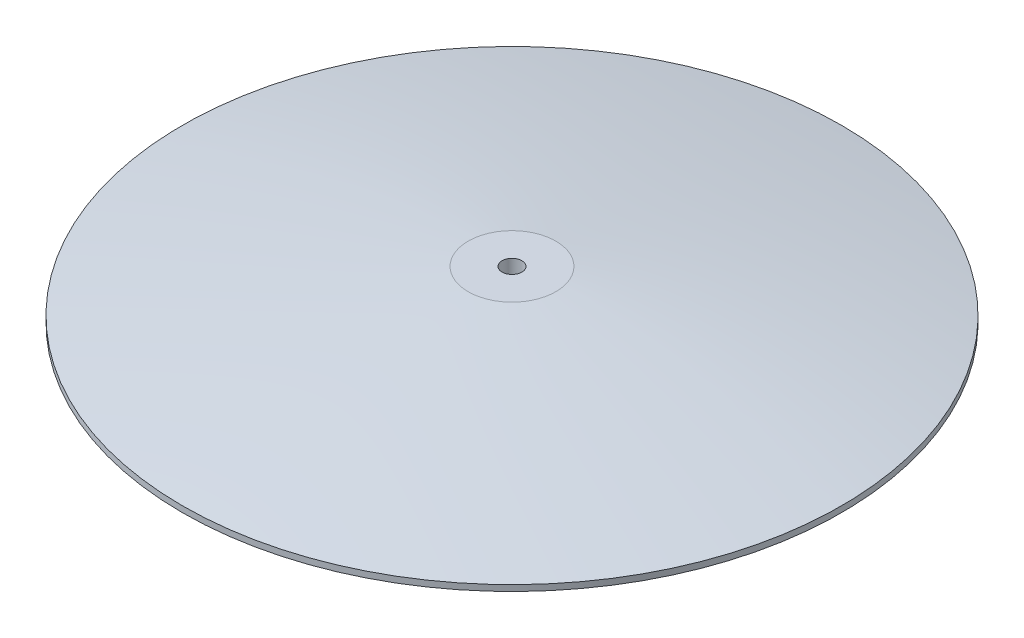
from build123d import *

# Parameters (mm, degrees)
SKETCH_3_R          = 1.65
CUT_EXTRUDE_1_DEPTH = 10


with BuildPart() as part:
    # 草图2 → 旋转1 (revolve)
    with BuildSketch(Plane.XY, mode=Mode.PRIVATE) as revolve_1_sk:
        with BuildLine():
            add(Edge.make_bspline(
                [(55, 0), (27.685198059, 4.68161458), (0, 5.229745909)],
                knots=[0, 0, 0, 1, 1, 1], degree=2))
            Line((55, 0), (55, 1))
            add(Edge.make_bspline(
                [(55, 1), (31.334793841, 5.839577235), (7.314066273, 8.101424417)],
                knots=[0, 0, 0, 0.867999985, 0.867999985, 0.867999985], degree=2))
            Line((7.314066273, 8.101424417), (0, 8.101424417))
            Line((0, 8.101424417), (0, 5.229745909))
        make_face()
    revolve(revolve_1_sk.sketch.rotate(Axis((0, 8.729745909, 0), (0, -1, 0)), 90), axis=Axis((0, 8.729745909, 0), (0, -1, 0)))

    # 草图3 → 切除-拉伸1 (cut)
    with BuildSketch(Plane(origin=(0, 8.101424417, 0), x_dir=(1, 0, 0), z_dir=(0, 1, 0))):
        with Locations(Location((0, 0, 0), (0, 0, 270))):
            Circle(SKETCH_3_R)
    extrude(amount=-CUT_EXTRUDE_1_DEPTH, mode=Mode.SUBTRACT)


solid = part.part
